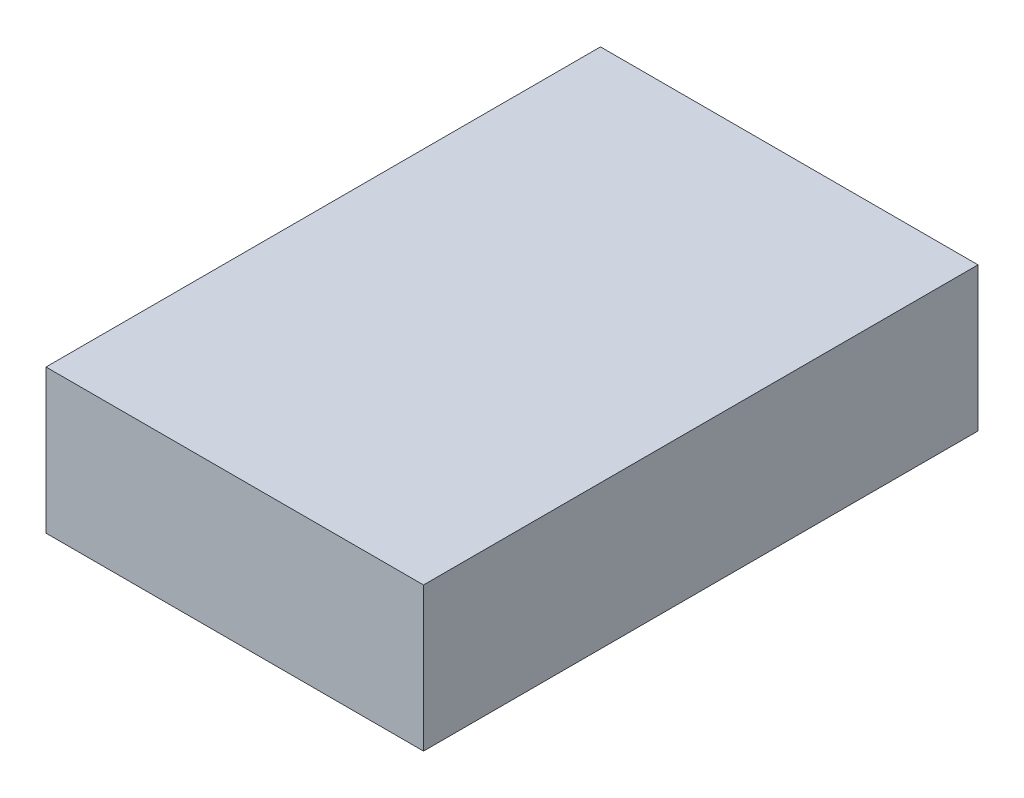
from build123d import *

# Parameters (mm, degrees)
SKETCH_1_W      = 32
SKETCH_1_H      = 47
EXTRUDE_1_DEPTH = 12.2


with BuildPart() as part:
    # 草图1 → 凸台-拉伸1 (new body)
    with BuildSketch(Plane(origin=(0, 0, 0), x_dir=(1, 0, 0), z_dir=(0, 1, 0))):
        Rectangle(SKETCH_1_W, SKETCH_1_H)
    extrude(amount=EXTRUDE_1_DEPTH)


solid = part.part
